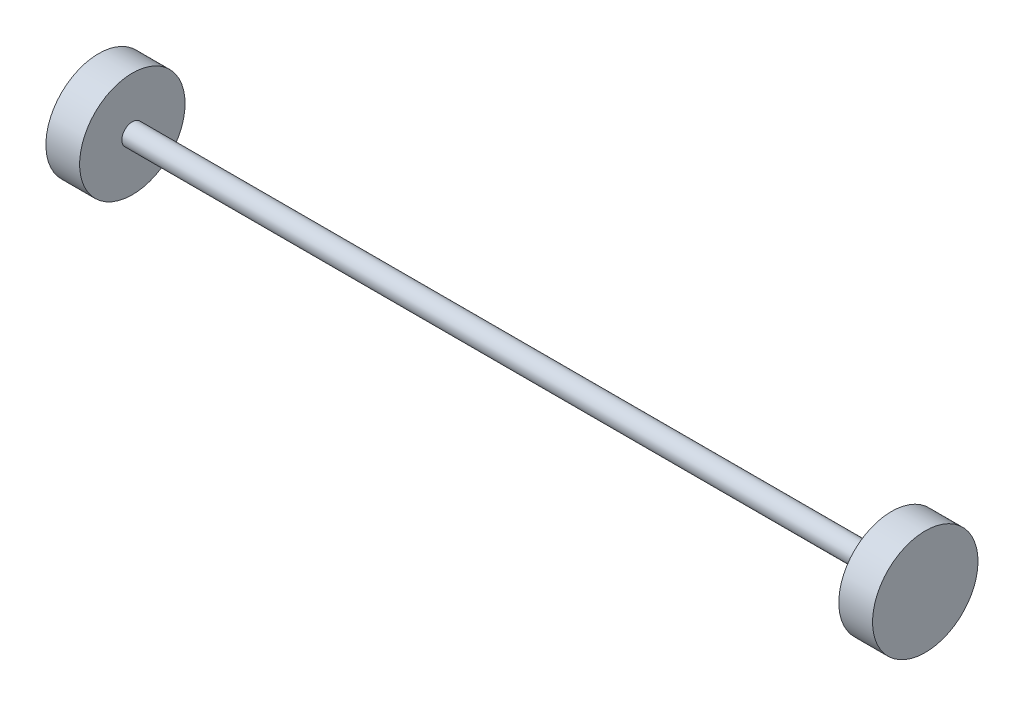
from build123d import *

# Parameters (mm, degrees)
SKETCH1_R           = 125
BOSS_EXTRUDE1_DEPTH = 80
SKETCH2_R           = 25
BOSS_EXTRUDE2_DEPTH = 1800
SKETCH3_R           = 125
BOSS_EXTRUDE3_DEPTH = 80


with BuildPart() as part:
    # Sketch1 → Boss-Extrude1 (new body)
    with BuildSketch(Plane(origin=(0, 0, 0), x_dir=(0, 0, -1), z_dir=(1, 0, 0))):
        Circle(SKETCH1_R)
    extrude(amount=BOSS_EXTRUDE1_DEPTH)

    # Sketch2 → Boss-Extrude2 (add)
    with BuildSketch(Plane(origin=(80, 0, 0), x_dir=(0, 0, -1), z_dir=(1, 0, 0))):
        Circle(SKETCH2_R)
    extrude(amount=BOSS_EXTRUDE2_DEPTH)

    # Sketch3 → Boss-Extrude3 (add)
    with BuildSketch(Plane(origin=(1880, 0, 0), x_dir=(0, 0, -1), z_dir=(1, 0, 0))):
        Circle(SKETCH3_R)
    extrude(amount=BOSS_EXTRUDE3_DEPTH)


solid = part.part
